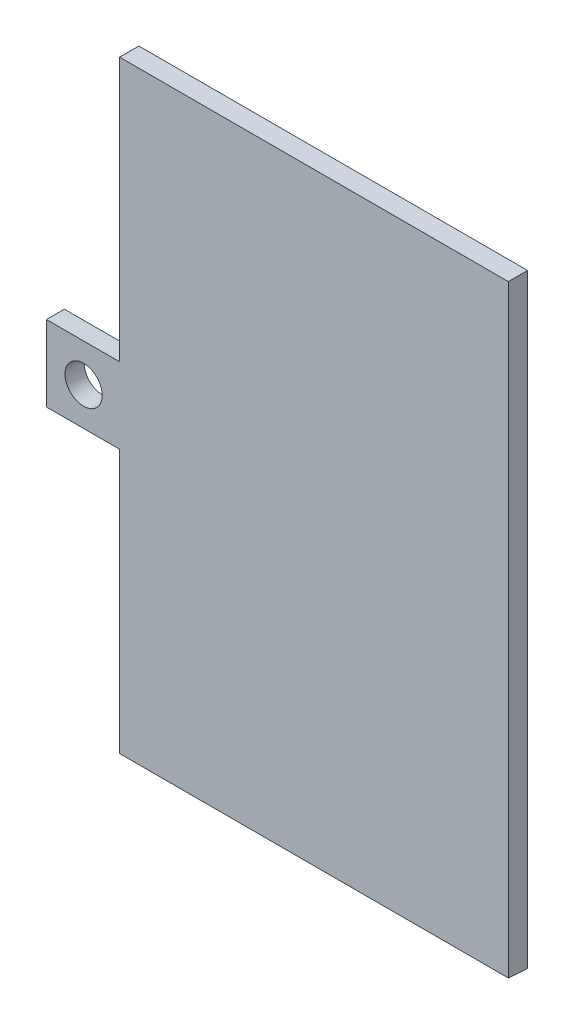
from build123d import *

# Parameters (mm, degrees)
SKETCH1_W                    = 49.765070753
SKETCH1_H                    = 64.93
BOSS_EXTRUDE1_DEPTH          = 2
BOSS_EXTRUDE1_TAPER          = 2
SKETCH3_R                    = 2
CUT_EXTRUDE2_DEPTH           = 2
CUT_EXTRUDE2_DRAFT           = -2
SKETCH4_W                    = 8
SKETCH4_H                    = 28.479841539
CUT_EXTRUDE3_DEPTH           = 2
CUT_EXTRUDE3_DRAFT           = -2
SKETCH4_H_2                  = 28.450158461
CUT_EXTRUDE3_PROFILE_2_DEPTH = 2
CUT_EXTRUDE3_PROFILE_2_DRAFT = -2


with BuildPart() as part:
    # Sketch1 → Boss-Extrude1 (new body)
    with BuildSketch(Plane.XY):
        with Locations((-98.472172046, 45.191977318)):
            Rectangle(SKETCH1_W, SKETCH1_H)
    extrude(amount=BOSS_EXTRUDE1_DEPTH, taper=BOSS_EXTRUDE1_TAPER)


with BuildPart() as cut_extrude2_tool:
    # Sketch3 → Cut-Extrude2 (with draft: the straight prism first)
    with BuildSketch(Plane.XY.offset(2)):
        with Locations((-119.284865883, 45.177135779)):
            Circle(SKETCH3_R)
    extrude(amount=-CUT_EXTRUDE2_DEPTH)
    # Cut-Extrude2: the draft: its side faces are tilted about the plane it starts from
    cut_extrude2_sides = [cut_extrude2_tool.faces().sort_by_distance(p)[0] for p in [
        (-121.284865883, 45.177135779, 1),
    ]]
    draft(cut_extrude2_sides, Plane.XY.offset(2), CUT_EXTRUDE2_DRAFT)


with BuildPart() as part_1:
    add(part.part)

    # Cut-Extrude2: cut by cut_extrude2_tool
    add(cut_extrude2_tool.part, mode=Mode.SUBTRACT)


with BuildPart() as cut_extrude3_tool:
    # Sketch4 → Cut-Extrude3 (with draft: the straight prism first)
    with BuildSketch(Plane(origin=(0, 0, 0), x_dir=(-1, 0, 0), z_dir=(0, 0, -1))):
        with Locations((119.354707422, 63.417056548)):
            Rectangle(SKETCH4_W, SKETCH4_H)
    extrude(amount=-CUT_EXTRUDE3_DEPTH)
    # Cut-Extrude3: the draft: its side faces are tilted about the plane it starts from
    cut_extrude3_sides = [cut_extrude3_tool.faces().sort_by_distance(p)[0] for p in [
        (-119.354707422, 77.656977318, 1),
        (-115.354707422, 63.417056548, 1),
        (-119.354707422, 49.177135779, 1),
        (-123.354707422, 63.417056548, 1),
    ]]
    draft(cut_extrude3_sides, Plane(origin=(0, 0, 0), x_dir=(-1, 0, 0), z_dir=(0, 0, -1)), CUT_EXTRUDE3_DRAFT)


with BuildPart() as part_2:
    add(part_1.part)

    # Cut-Extrude3: cut by cut_extrude3_tool
    add(cut_extrude3_tool.part, mode=Mode.SUBTRACT)


with BuildPart() as cut_extrude3_profile_2_tool:
    # Sketch4 → Cut-Extrude3 profile 2 (with draft: the straight prism first)
    with BuildSketch(Plane(origin=(0, 0, 0), x_dir=(-1, 0, 0), z_dir=(0, 0, -1))):
        with Locations((119.354707422, 26.952056549)):
            Rectangle(SKETCH4_W, SKETCH4_H_2)
    extrude(amount=-CUT_EXTRUDE3_PROFILE_2_DEPTH)
    # Cut-Extrude3 profile 2: the draft: its side faces are tilted about the plane it starts from
    cut_extrude3_profile_2_sides = [cut_extrude3_profile_2_tool.faces().sort_by_distance(p)[0] for p in [
        (-123.354707422, 26.952056548, 1),
        (-119.354707422, 41.177135779, 1),
        (-115.354707422, 26.952056548, 1),
        (-119.354707422, 12.726977318, 1),
    ]]
    draft(cut_extrude3_profile_2_sides, Plane(origin=(0, 0, 0), x_dir=(-1, 0, 0), z_dir=(0, 0, -1)), CUT_EXTRUDE3_PROFILE_2_DRAFT)


with BuildPart() as part_3:
    add(part_2.part)

    # Cut-Extrude3 profile 2: cut by cut_extrude3_profile_2_tool
    add(cut_extrude3_profile_2_tool.part, mode=Mode.SUBTRACT)


solid = part_3.part
